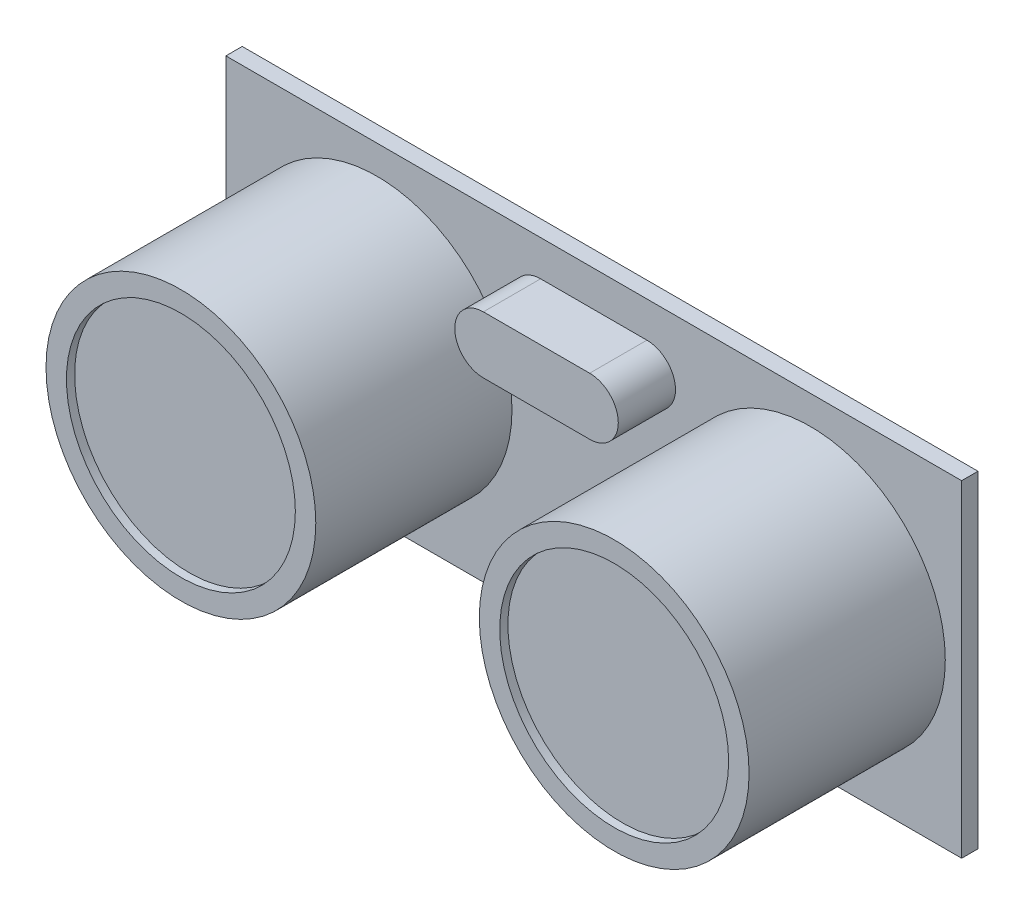
from build123d import *

# Parameters (mm, degrees)
ESBO_O1_W                = 45
ESBO_O1_H                = 20
RESSALTO_EXTRUS_O1_DEPTH = 1
ESBO_O2_R                = 8.25
RESSALTO_EXTRUS_O2_DEPTH = 12
ESBO_O3_R                = 7
CORTE_EXTRUS_O1_DEPTH    = 0.5
ESBO_O6_R                = 1.75
RESSALTO_EXTRUS_O5_DEPTH = 3.5
ESBO_O7_W                = 1.8
ESBO_O7_H                = 1.8
ESBO_O7_W_2              = 0.9
ESBO_O7_H_2              = 0.1
RESSALTO_EXTRUS_O6_DEPTH = 2
ESBO_O9_W                = 10
ESBO_O9_H                = 0.1
CORTE_EXTRUS_O2_DEPTH    = 2
ESBO_O10_W               = 1
ESBO_O10_H               = 1
RESSALTO_EXTRUS_O7_DEPTH = 2
ESBO_O11_W               = 1
ESBO_O11_H               = 1
ESBO_O11_H_2             = 0.967747288
RESSALTO_EXTRUS_O8_DEPTH = 4


with BuildPart() as part:
    # Esboço1 → Ressalto-extrusão1 (new body)
    with BuildSketch(Plane.XY):
        with Locations((22.5, 10)):
            Rectangle(ESBO_O1_W, ESBO_O1_H)
    extrude(amount=RESSALTO_EXTRUS_O1_DEPTH)

    # Esboço2 → Ressalto-extrusão2 (add)
    with BuildSketch(Plane.XY.offset(1)):
        with Locations(Location((9.25, 10, 0), (0, 0, 180))):
            Circle(ESBO_O2_R)
        with Locations(Location((35.75, 10, 0), (0, 0, 180))):
            Circle(ESBO_O2_R)
    extrude(amount=RESSALTO_EXTRUS_O2_DEPTH)

    # Esboço3 → Corte-extrusão1 (cut)
    with BuildSketch(Plane.XY.offset(13)):
        with Locations((9.25, 10)):
            Circle(ESBO_O3_R)
        with Locations((35.75, 10)):
            Circle(ESBO_O3_R)
    extrude(amount=-CORTE_EXTRUS_O1_DEPTH, mode=Mode.SUBTRACT)

    # Esboço6 → Ressalto-extrusão5 (add)
    with BuildSketch(Plane.XY.offset(1)):
        with Locations((19.25, 16.066758405)):
            Circle(ESBO_O6_R)
        with BuildLine():
            Line((22.5, 14.316758405), (22.5, 17.816758405))
            Line((22.5, 17.816758405), (19.25, 17.816758405))
            ThreePointArc((19.25, 17.816758405), (20.487436867, 17.304195272), (21, 16.066758405))
            ThreePointArc((21, 16.066758405), (20.487436867, 14.829321538), (19.25, 14.316758405))
            Line((19.25, 14.316758405), (22.5, 14.316758405))
        make_face()
        with BuildLine():
            Line((25.75, 17.816758405), (22.5, 17.816758405))
            Line((22.5, 17.816758405), (22.5, 14.316758405))
            Line((22.5, 14.316758405), (25.75, 14.316758405))
            ThreePointArc((25.75, 14.316758405), (24, 16.066758405), (25.75, 17.816758405))
        make_face()
        with Locations((25.75, 16.066758405)):
            Circle(ESBO_O6_R)
    extrude(amount=RESSALTO_EXTRUS_O5_DEPTH)

    # Esboço7 → Ressalto-extrusão6 (add)
    with BuildSketch(Plane(origin=(0, 0, 0), x_dir=(-1, 0, 0), z_dir=(0, 0, -1))):
        with Locations((-26.5, 1)):
            Rectangle(ESBO_O7_W, ESBO_O7_H)
        with Locations((-24.5, 1)):
            Rectangle(ESBO_O7_W, ESBO_O7_H)
        with Locations((-22.95, 1)):
            Rectangle(ESBO_O7_W_2, ESBO_O7_H)
        with Locations((-22.05, 1)):
            Rectangle(ESBO_O7_W_2, ESBO_O7_H)
        with Locations((-20.5, 1)):
            Rectangle(ESBO_O7_W, ESBO_O7_H)
        with Locations((-18.5, 1)):
            Rectangle(ESBO_O7_W, ESBO_O7_H)
        Polygon((-27.5, 2), (-27.5, 0), (-25.6, 0), (-25.6, 0.1), (-27.4, 0.1), (-27.4, 1.9), (-25.6, 1.9), (-25.6, 2), align=None)
        with Locations((-24.5, 1.95)):
            Rectangle(ESBO_O7_W, ESBO_O7_H_2)
        with Locations((-22.95, 1.95)):
            Rectangle(ESBO_O7_W_2, ESBO_O7_H_2)
        with Locations((-22.05, 1.95)):
            Rectangle(ESBO_O7_W_2, ESBO_O7_H_2)
        with Locations((-20.5, 1.95)):
            Rectangle(ESBO_O7_W, ESBO_O7_H_2)
        Polygon((-19.4, 0), (-17.5, 0), (-17.5, 2), (-19.4, 2), (-19.4, 1.9), (-17.6, 1.9), (-17.6, 0.1), (-19.4, 0.1), align=None)
        with Locations((-24.5, 0.05)):
            Rectangle(ESBO_O7_W, ESBO_O7_H_2)
        with Locations((-22.95, 0.05)):
            Rectangle(ESBO_O7_W_2, ESBO_O7_H_2)
        with Locations((-22.05, 0.05)):
            Rectangle(ESBO_O7_W_2, ESBO_O7_H_2)
        with Locations((-20.5, 0.05)):
            Rectangle(ESBO_O7_W, ESBO_O7_H_2)
    extrude(amount=RESSALTO_EXTRUS_O6_DEPTH)

    # Esboço9 → Corte-extrusão2 (cut)
    with BuildSketch(Plane(origin=(0, 0, -2), x_dir=(-1, 0, 0), z_dir=(0, 0, -1))):
        with Locations((-22.5, 0.05)):
            Rectangle(ESBO_O9_W, ESBO_O9_H)
    extrude(amount=-CORTE_EXTRUS_O2_DEPTH, mode=Mode.SUBTRACT)

    # Esboço10 → Ressalto-extrusão7 (add)
    with BuildSketch(Plane(origin=(0, 0, -2), x_dir=(-1, 0, 0), z_dir=(0, 0, -1))):
        with Locations((-24.5, 1.05)):
            Rectangle(ESBO_O10_W, ESBO_O10_H)
        with Locations((-26.55, 1.05)):
            Rectangle(ESBO_O10_W, ESBO_O10_H)
        with Locations((-22.472435469, 1.05)):
            Rectangle(ESBO_O10_W, ESBO_O10_H)
        with Locations((-20.46939422, 1.05)):
            Rectangle(ESBO_O10_W, ESBO_O10_H)
        with Locations((-18.471440092, 1.05)):
            Rectangle(ESBO_O10_W, ESBO_O10_H)
    extrude(amount=RESSALTO_EXTRUS_O7_DEPTH)

    # Esboço11 → Ressalto-extrusão8 (add)
    with BuildSketch(Plane.XZ.offset(-0.55)):
        with Locations((26.55, -3.5)):
            Rectangle(ESBO_O11_W, ESBO_O11_H)
        with Locations((24.5, -3.5)):
            Rectangle(ESBO_O11_W, ESBO_O11_H)
        with Locations((22.472435469, -3.516126356)):
            Rectangle(ESBO_O11_W, ESBO_O11_H_2)
        with Locations((20.46939422, -3.516126356)):
            Rectangle(ESBO_O11_W, ESBO_O11_H_2)
        with Locations((18.471440092, -3.516126356)):
            Rectangle(ESBO_O11_W, ESBO_O11_H_2)
    extrude(amount=RESSALTO_EXTRUS_O8_DEPTH)


solid = part.part
